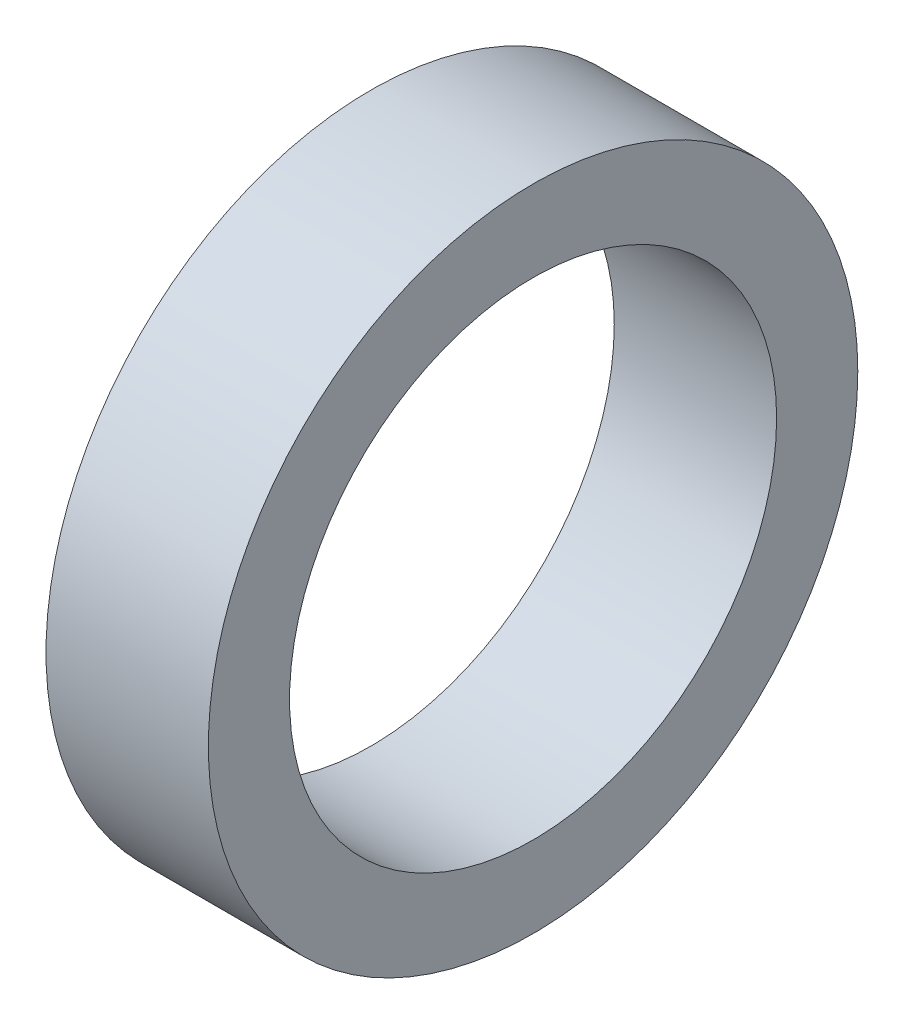
from build123d import *

# Parameters (mm, degrees)
SKETCH1_R           = 3.175
SKETCH1_R_2         = 2.38125
BOSS_EXTRUDE1_DEPTH = 1.5875


with BuildPart() as part:
    # Sketch1 → Boss-Extrude1 (new body)
    with BuildSketch(Plane(origin=(0, 0, 0), x_dir=(0, 0, -1), z_dir=(1, 0, 0))):
        Circle(SKETCH1_R)
        Circle(SKETCH1_R_2, mode=Mode.SUBTRACT)
    extrude(amount=BOSS_EXTRUDE1_DEPTH)


solid = part.part
